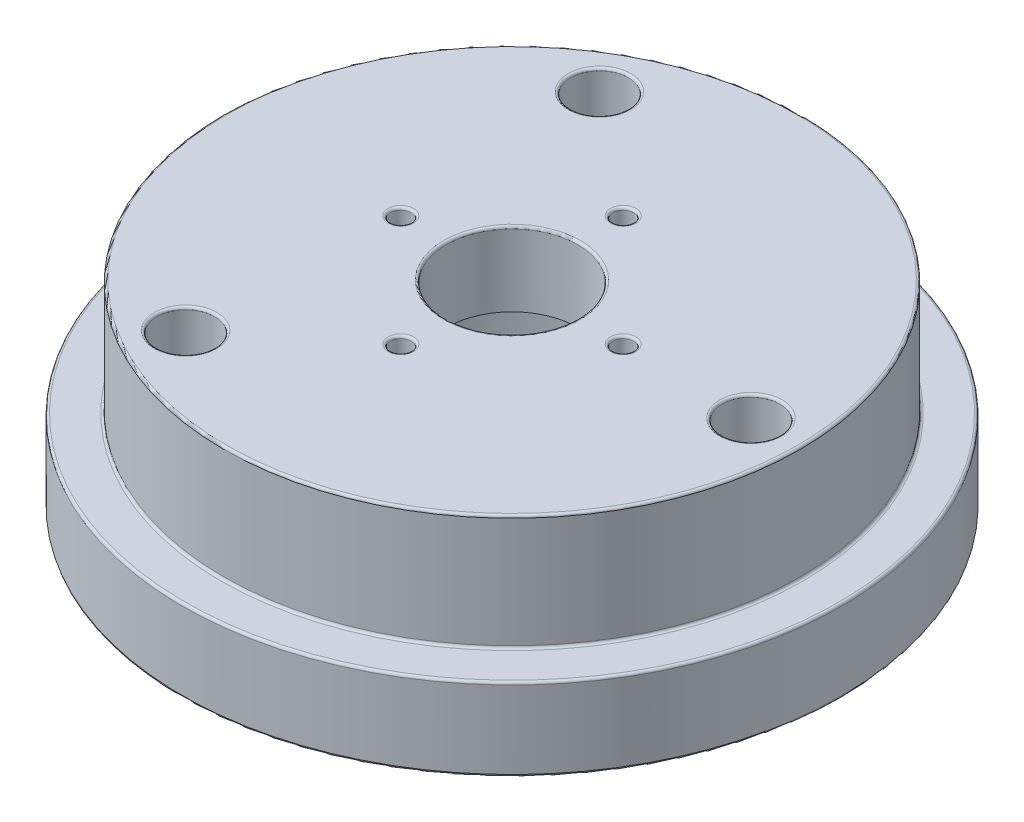
from build123d import *

# Parameters (mm, degrees)
SKETCH2_R          = 1.75
SKETCH2_R_2        = 4
SKETCH2_R_3        = 0.625
CUT_EXTRUDE1_DEPTH = 31.724582991
SKETCH2_3_R        = 10
SKETCH2_3_R_2      = 0.625
SKETCH2_3_R_3      = 4
CUT_EXTRUDE2_DEPTH = 7.5
FILLET1_R          = 0.15


with BuildPart() as part:
    # Sketch1 → Revolve1 (revolve)
    with BuildSketch(Plane.XY):
        Polygon((0, 0), (-20, 0), (-20, 5), (-17.5, 5), (-17.5, 12), (0, 12), align=None)
    revolve(axis=Axis((0, 12, 0), (0, -1, 0)))

    # Sketch2 → Cut-Extrude1 (cut, through all)
    with BuildSketch(Plane.XZ):
        with Locations((14.5, 0)):
            Circle(SKETCH2_R)
        with Locations((-7.25, -12.557368355)):
            Circle(SKETCH2_R)
        with Locations((-7.25, 12.557368355)):
            Circle(SKETCH2_R)
        Circle(SKETCH2_R_2)
        with Locations((6.75, 0)):
            Circle(SKETCH2_R_3)
        with Locations((0, -6.75)):
            Circle(SKETCH2_R_3)
        with Locations((-6.75, 0)):
            Circle(SKETCH2_R_3)
        with Locations((0, 6.75)):
            Circle(SKETCH2_R_3)
    extrude(amount=-CUT_EXTRUDE1_DEPTH, mode=Mode.SUBTRACT)

    # Sketch2<3> → Cut-Extrude2 (cut)
    with BuildSketch(Plane.XZ):
        Circle(SKETCH2_3_R)
        with Locations((-6.75, 0)):
            Circle(SKETCH2_3_R_2, mode=Mode.SUBTRACT)
        with Locations((0, -6.75)):
            Circle(SKETCH2_3_R_2, mode=Mode.SUBTRACT)
        Circle(SKETCH2_3_R_3, mode=Mode.SUBTRACT)
        with Locations((6.75, 0)):
            Circle(SKETCH2_3_R_2, mode=Mode.SUBTRACT)
        with Locations((0, 6.75)):
            Circle(SKETCH2_3_R_2, mode=Mode.SUBTRACT)
    extrude(amount=-CUT_EXTRUDE2_DEPTH, mode=Mode.SUBTRACT)

    # Fillet1
    fillet1_edges = [part.edges().sort_by_distance(p)[0] for p in [
        (20, 0, 0),
        (-9, 0, -12.557368355),
        (12.75, 0, 0),
        (-9, 0, 12.557368355),
        (-10, 0, 0),
        (17.5, 5, 0),
        (20, 5, 0),
        (17.5, 12, 0),
        (-0.625, 12, -6.75),
        (6.125, 12, 0),
        (-0.625, 12, 6.75),
        (-4, 12, 0),
        (-7.375, 12, 0),
        (-9, 12, -12.557368355),
        (12.75, 12, 0),
        (-9, 12, 12.557368355),
    ]]
    fillet(fillet1_edges, radius=FILLET1_R)


solid = part.part
